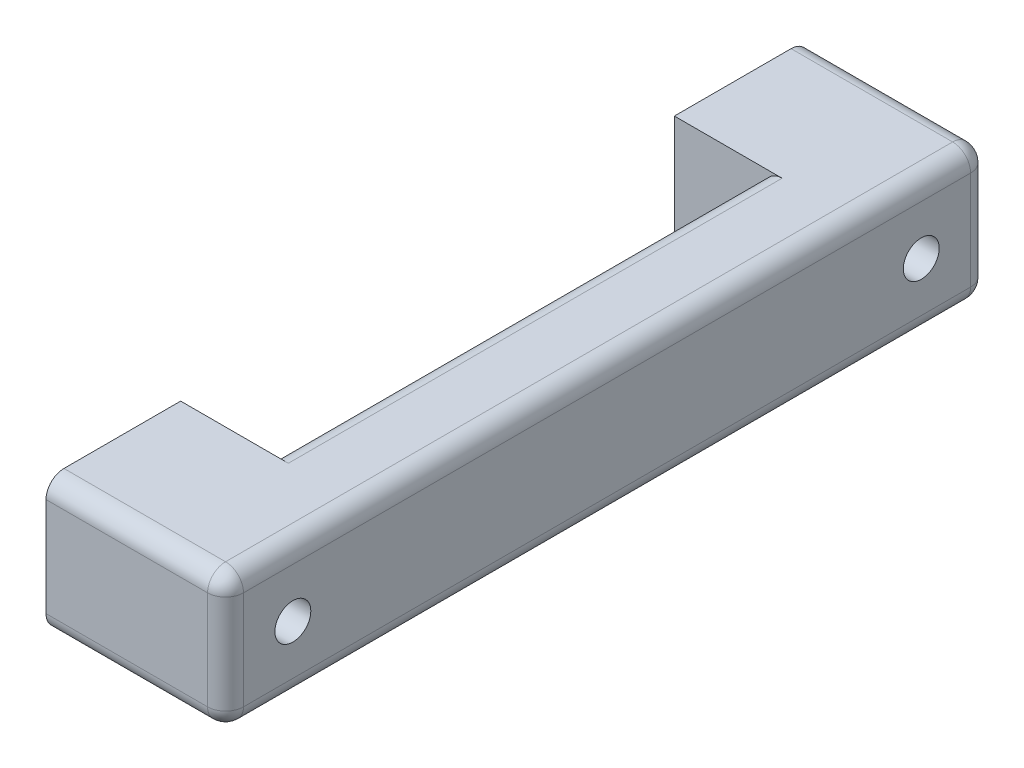
from build123d import *

# Parameters (mm, degrees)
SKETCH1_W           = 85
SKETCH1_H           = 15
BOSS_EXTRUDE1_DEPTH = 10
SKETCH2_W           = 15
SKETCH2_H           = 15
BOSS_EXTRUDE2_DEPTH = 10
FILLET3_R           = 2
SKETCH3_R           = 2
CUT_EXTRUDE1_DEPTH  = 48.565743976


with BuildPart() as part:
    # Sketch1 → Boss-Extrude1 (new body)
    with BuildSketch(Plane(origin=(0, 0, 0), x_dir=(0, 0, -1), z_dir=(1, 0, 0))):
        Rectangle(SKETCH1_W, SKETCH1_H)
    extrude(amount=BOSS_EXTRUDE1_DEPTH)

    # Sketch2 → Boss-Extrude2 (add)
    with BuildSketch(Plane.ZY):
        with Locations((-35, 0)):
            Rectangle(SKETCH2_W, SKETCH2_H)
        with Locations((35, 0)):
            Rectangle(SKETCH2_W, SKETCH2_H)
    extrude(amount=BOSS_EXTRUDE2_DEPTH)

    # Fillet3
    fillet3_edges = [part.edges().sort_by_distance(p)[0] for p in [
        (10, 0, 42.5),
        (0, -7.5, 0),
        (0, 7.5, 0),
        (10, -7.5, 0),
        (10, 0, -42.5),
        (0, -7.5, -42.5),
        (0, -7.5, 42.5),
        (0, 7.5, 42.5),
        (0, 7.5, -42.5),
        (10, 7.5, 0),
    ]]
    fillet(fillet3_edges, radius=FILLET3_R)

    # Sketch3 → Cut-Extrude1 (cut, through all)
    with BuildSketch(Plane.ZY.offset(10)):
        with Locations((-35, 0)):
            Circle(SKETCH3_R)
        with Locations(Location((35, 0, 0), (0, 0, 180))):
            Circle(SKETCH3_R)
    extrude(amount=-CUT_EXTRUDE1_DEPTH, mode=Mode.SUBTRACT)


solid = part.part
